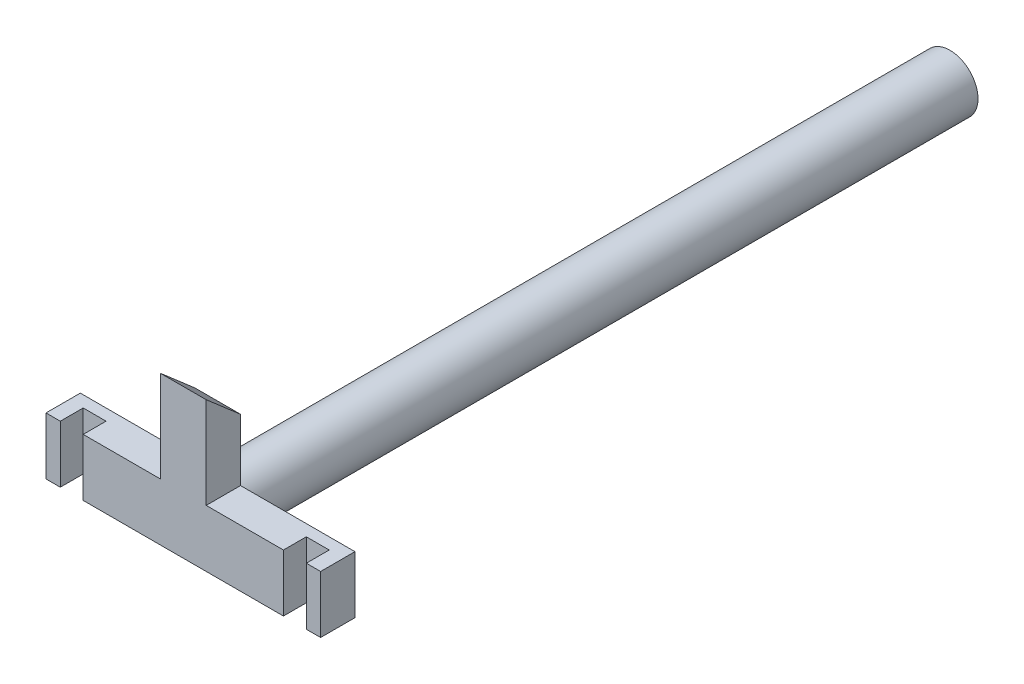
from build123d import *

# Parameters (mm, degrees)
SKETCH1_R           = 2.45
BOSS_EXTRUDE1_DEPTH = 64
SKETCH2_W           = 24
SKETCH2_H           = 5
BOSS_EXTRUDE2_DEPTH = 3
SKETCH3_W           = 2
SKETCH3_H           = 5
CUT_EXTRUDE2_DEPTH  = 2
SKETCH4_W           = 4
SKETCH4_H           = 8
BOSS_EXTRUDE3_DEPTH = 3
CUT_EXTRUDE3_REACH  = 71.248


with BuildPart() as part:
    # Sketch1 → Boss-Extrude1 (new body)
    with BuildSketch(Plane.XY):
        Circle(SKETCH1_R)
    extrude(amount=BOSS_EXTRUDE1_DEPTH)

    # Sketch2 → Boss-Extrude2 (add)
    with BuildSketch(Plane.XY.offset(64)):
        Rectangle(SKETCH2_W, SKETCH2_H)
    extrude(amount=BOSS_EXTRUDE2_DEPTH)

    # Sketch3 → Cut-Extrude2 (cut)
    with BuildSketch(Plane.XY.offset(67)):
        with Locations((9.75, 0)):
            Rectangle(SKETCH3_W, SKETCH3_H)
        with Locations((-9.75, 0)):
            Rectangle(SKETCH3_W, SKETCH3_H)
    extrude(amount=-CUT_EXTRUDE2_DEPTH, mode=Mode.SUBTRACT)

    # Sketch4 → Boss-Extrude3 (add)
    with BuildSketch(Plane.XY.offset(67)):
        with Locations((0, 6.5)):
            Rectangle(SKETCH4_W, SKETCH4_H)
    extrude(amount=-BOSS_EXTRUDE3_DEPTH)

    # Sketch5 → Cut-Extrude3 (cut, up to next)
    with BuildSketch(Plane(origin=(2, 0, 0), x_dir=(0, 0, -1), z_dir=(1, 0, 0)), mode=Mode.PRIVATE) as cut_extrude3_sk1:
        Polygon((-67, 10.5), (-64, 7.9), (-64, 10.5), align=None)
    cut_extrude3_tool1 = extrude(cut_extrude3_sk1.sketch, amount=-CUT_EXTRUDE3_REACH, mode=Mode.PRIVATE) & part.part
    add(cut_extrude3_tool1.solids().sort_by_distance((2, 9.633333, 65))[0], mode=Mode.SUBTRACT)


solid = part.part
